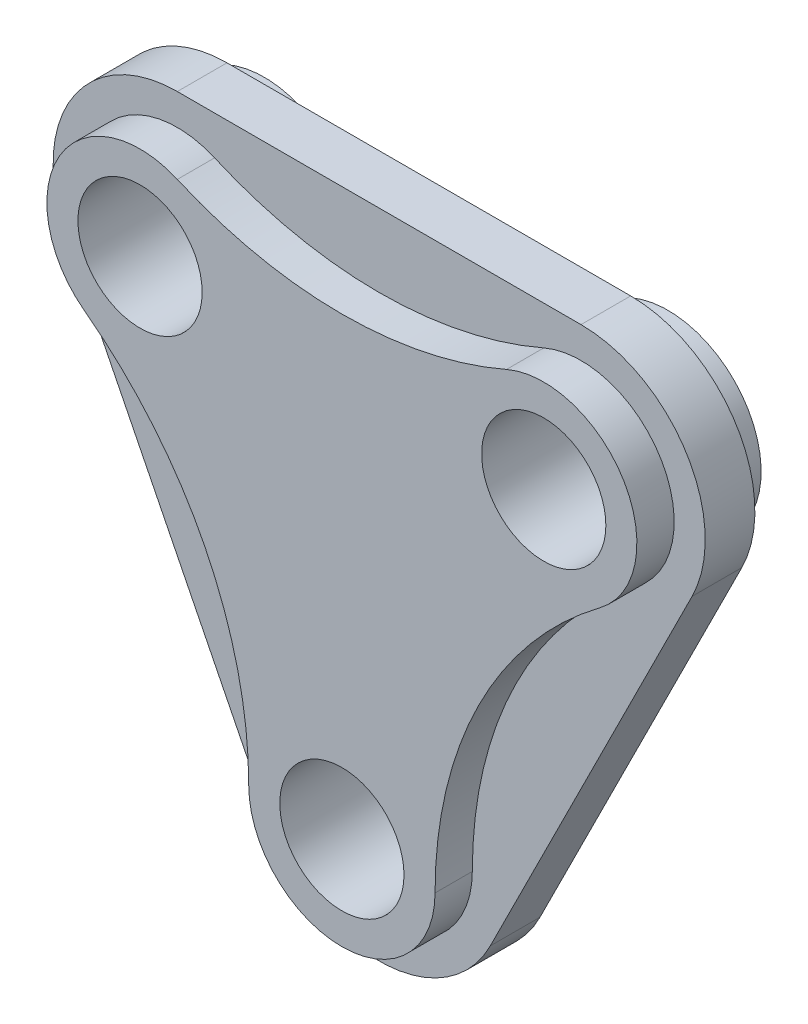
from build123d import *

# Parameters (mm, degrees)
SKETCH1_R           = 10
BOSS_EXTRUDE1_DEPTH = 10
BOSS_EXTRUDE3_DEPTH = 4


with BuildPart() as part:
    # Sketch1 → Boss-Extrude1 (new, symmetric)
    with BuildSketch(Plane.XY):
        with BuildLine():
            ThreePointArc((15, -65), (21.994198596, -35.372099298), (41.5, -12))
            ThreePointArc((41.5, -12), (45.460955309, 7.550737546), (26.5, 13.747727085))
            ThreePointArc((26.5, 13.747727085), (0, 8.216855043), (-26.5, 13.747727085))
            ThreePointArc((-26.5, 13.747727085), (-45.460955309, 7.550737546), (-41.5, -12))
            ThreePointArc((-41.5, -12), (-21.994198596, -35.372099298), (-15, -65))
            ThreePointArc((-15, -65), (0, -80), (15, -65))
        make_face()
        with Locations((-32.5, 0)):
            Circle(SKETCH1_R, mode=Mode.SUBTRACT)
        with Locations((32.5, 0)):
            Circle(SKETCH1_R, mode=Mode.SUBTRACT)
        with Locations((0, -65)):
            Circle(SKETCH1_R, mode=Mode.SUBTRACT)
    extrude(amount=BOSS_EXTRUDE1_DEPTH, both=True)

    # Sketch1<4> → Boss-Extrude3 (add, symmetric)
    with BuildSketch(Plane.XY):
        with BuildLine():
            ThreePointArc((-32.5, 20), (-49.513016167, 10.514622242), (-50.38854382, -8.94427191))
            Line((-50.38854382, -8.94427191), (-17.88854382, -73.94427191))
            ThreePointArc((-17.88854382, -73.94427191), (0, -85), (17.88854382, -73.94427191))
            Line((17.88854382, -73.94427191), (50.38854382, -8.94427191))
            ThreePointArc((50.38854382, -8.94427191), (49.513016167, 10.514622242), (32.5, 20))
            Line((32.5, 20), (-32.5, 20))
        make_face()
        with BuildLine():
            ThreePointArc((26.5, 13.747727085), (45.460955309, 7.550737546), (41.5, -12))
            ThreePointArc((41.5, -12), (21.994198596, -35.372099298), (15, -65))
            ThreePointArc((15, -65), (0, -80), (-15, -65))
            ThreePointArc((-15, -65), (-21.994198596, -35.372099298), (-41.5, -12))
            ThreePointArc((-41.5, -12), (-45.460955309, 7.550737546), (-26.5, 13.747727085))
            ThreePointArc((-26.5, 13.747727085), (0, 8.216855043), (26.5, 13.747727085))
        make_face(mode=Mode.SUBTRACT)
    extrude(amount=BOSS_EXTRUDE3_DEPTH, both=True)


solid = part.part
